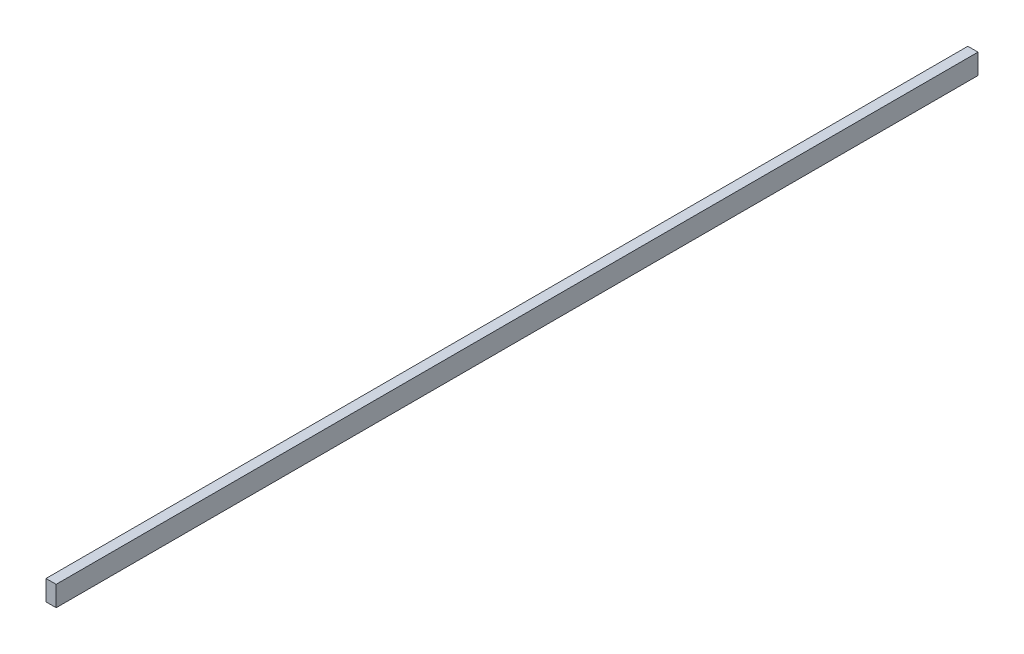
from build123d import *

# Parameters (mm, degrees)
SKETCH1_W           = 3.175
SKETCH1_H           = 6.35
BOSS_EXTRUDE1_DEPTH = 288.29


with BuildPart() as part:
    # Sketch1 → Boss-Extrude1 (new body)
    with BuildSketch(Plane.XY):
        with Locations((1.5875, 3.175)):
            Rectangle(SKETCH1_W, SKETCH1_H)
    extrude(amount=BOSS_EXTRUDE1_DEPTH)


solid = part.part
